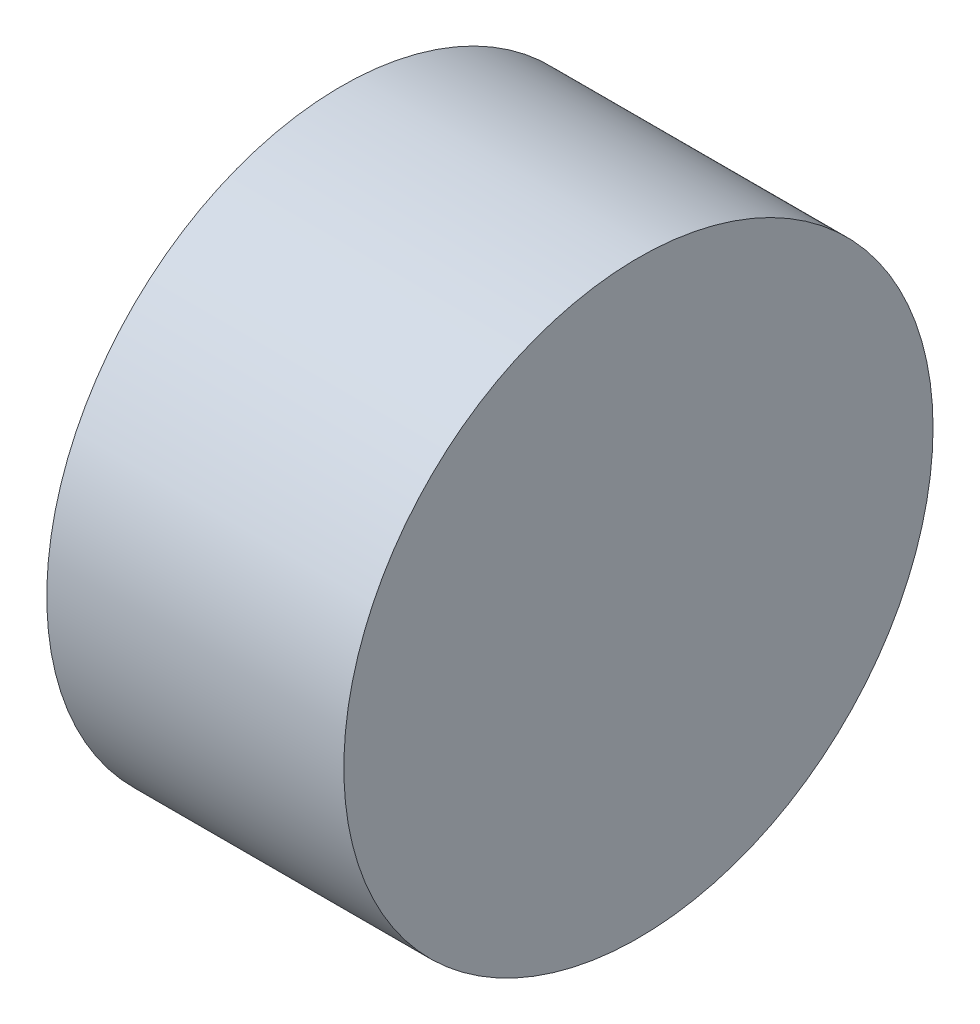
from build123d import *


with BuildPart() as part:
    # Sketch5 → Revolve1 (revolve)
    with BuildSketch(Plane(origin=(0, 0, 0), x_dir=(1, 0, 0), z_dir=(0, 1, 0)), mode=Mode.PRIVATE) as revolve1_sk:
        Polygon((150.7, 0), (150.7, -8.8), (143, -10.9), (143, -12), (155.1, -12), (155.1, 0), align=None)
    revolve(revolve1_sk.sketch.rotate(Axis((155.1, 0, 0), (-1, 0, 0)), 180), axis=Axis((155.1, 0, 0), (-1, 0, 0)))


solid = part.part
